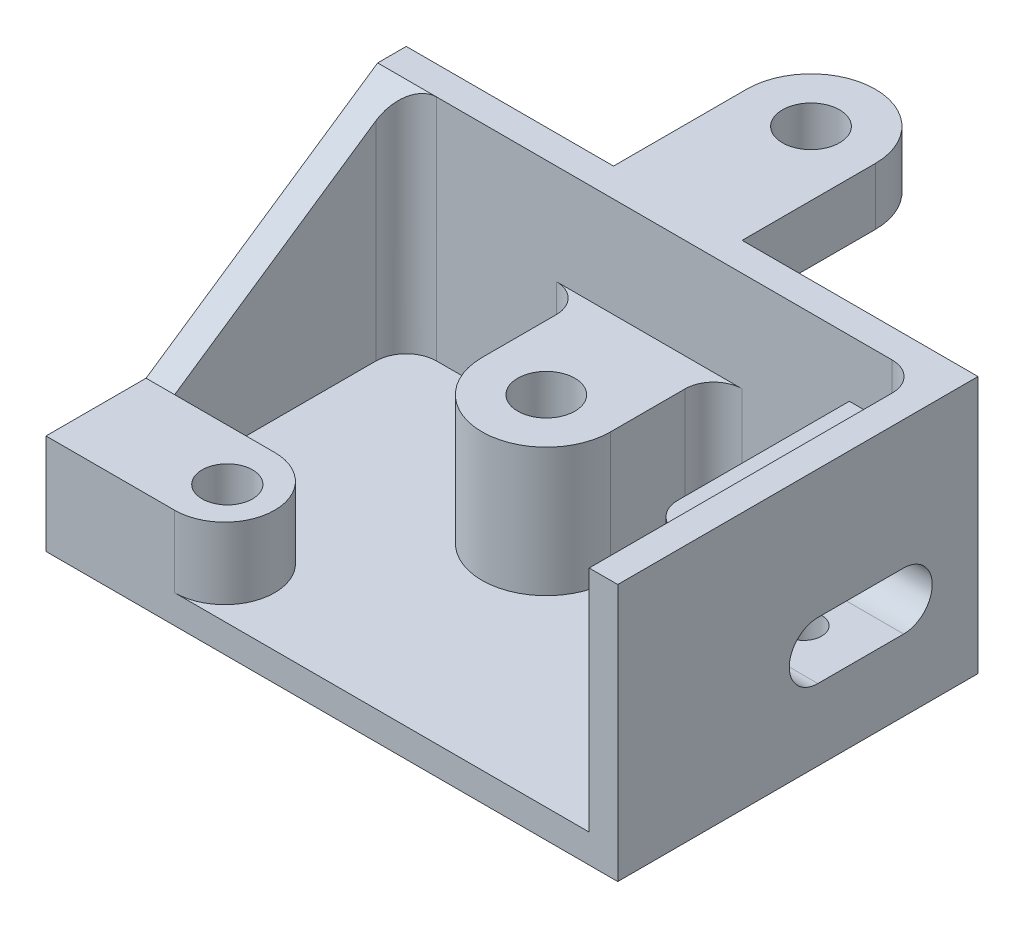
from build123d import *

# Parameters (mm, degrees)
BOSS_EXTRUDE1_DEPTH                                  = 6.35
BOSS_EXTRUDE2_DEPTH                                  = 57.15
BOSS_EXTRUDE3_DEPTH                                  = 44.45
BOSS_EXTRUDE4_DEPTH                                  = 34.925
SKETCH4_R                                            = 14.2875
SKETCH4_R_2                                          = 6.35
BOSS_EXTRUDE5_DEPTH                                  = 12.7
CUT_EXTRUDE1_REACH                                   = 159.28
BOSS_EXTRUDE6_DEPTH                                  = 15.875
CBORE_FOR_M5_CROSS_RECESS_PAN_HEAD_SCREW_D           = 11.2014
CBORE_FOR_M5_CROSS_RECESS_PAN_HEAD_SCREW_CBORE_D     = 15.875
CBORE_FOR_M5_CROSS_RECESS_PAN_HEAD_SCREW_CBORE_DEPTH = 3.175
CBORE_FOR_M5_CROSS_RECESS_PAN_HEAD_S_2_D             = 12.7
CBORE_FOR_M5_CROSS_RECESS_PAN_HEAD_S_2_CBORE_D       = 22.225
CBORE_FOR_M5_CROSS_RECESS_PAN_HEAD_S_2_CBORE_DEPTH   = 3.175
CUT_EXTRUDE3_REACH                                   = 159.28
CUT_EXTRUDE4_REACH                                   = 116.252
SKETCH18_R                                           = 4.0005


with BuildPart() as part:
    # Sketch1 → Boss-Extrude1 (new body)
    with BuildSketch(Plane(origin=(0, 0, 0), x_dir=(1, 0, 0), z_dir=(0, 1, 0))):
        with BuildLine():
            Line((60.325, 16.51822322), (60.325, -28.346886894))
            Line((60.325, -28.346886894), (60.325, -50.8))
            Line((60.325, -50.8), (66.675, -50.8))
            Line((66.675, -50.8), (66.675, 29.21822322))
            Line((66.675, 29.21822322), (-60.325, 29.21822322))
            Line((-60.325, 29.21822322), (-60.325, -50.8))
            Line((-60.325, -50.8), (-53.975, -50.8))
            Line((-53.975, -50.8), (-53.975, -44.45))
            Line((-53.975, -44.45), (-53.975, 16.103113106))
            ThreePointArc((-53.975, 16.103113106), (-51.993545123, 20.886768343), (-47.209889886, 22.86822322))
            Line((-47.209889886, 22.86822322), (-20.6375, 22.86822322))
            Line((-20.6375, 22.86822322), (20.6375, 22.86822322))
            Line((20.6375, 22.86822322), (44.45, 22.86822322))
            Line((44.45, 22.86822322), (53.975, 22.86822322))
            ThreePointArc((53.975, 22.86822322), (58.465128061, 21.00835128), (60.325, 16.51822322))
        make_face()
        with BuildLine():
            Line((60.325, -50.8), (60.325, -28.346886894))
            ThreePointArc((60.325, -28.346886894), (58.343545123, -23.563231657), (53.559889886, -21.58177678))
            Line((53.559889886, -21.58177678), (50.8, -21.58177678))
            ThreePointArc((50.8, -21.58177678), (46.309871939, -19.721904841), (44.45, -15.23177678))
            Line((44.45, -15.23177678), (44.45, 22.86822322))
            Line((44.45, 22.86822322), (20.6375, 22.86822322))
            ThreePointArc((20.6375, 22.86822322), (16.147371939, 21.00835128), (14.2875, 16.51822322))
            Line((14.2875, 16.51822322), (14.2875, 0))
            ThreePointArc((14.2875, 0), (0, -14.2875), (-14.2875, 0))
            Line((-14.2875, 0), (-14.2875, 16.51822322))
            ThreePointArc((-14.2875, 16.51822322), (-16.147371939, 21.00835128), (-20.6375, 22.86822322))
            Line((-20.6375, 22.86822322), (-47.209889886, 22.86822322))
            ThreePointArc((-47.209889886, 22.86822322), (-51.993545123, 20.886768343), (-53.975, 16.103113106))
            Line((-53.975, 16.103113106), (-53.975, -44.45))
            Line((-53.975, -44.45), (-53.975, -50.8))
            Line((-53.975, -50.8), (-47.625, -50.8))
            Line((-47.625, -50.8), (60.325, -50.8))
        make_face()
        with BuildLine():
            Line((-20.6375, 22.86822322), (20.6375, 22.86822322))
            ThreePointArc((20.6375, 22.86822322), (16.147371939, 21.00835128), (14.2875, 16.51822322))
            Line((14.2875, 16.51822322), (14.2875, 0))
            ThreePointArc((14.2875, 0), (0, -14.2875), (-14.2875, 0))
            Line((-14.2875, 0), (-14.2875, 16.51822322))
            ThreePointArc((-14.2875, 16.51822322), (-16.147371939, 21.00835128), (-20.6375, 22.86822322))
        make_face()
        with BuildLine():
            ThreePointArc((53.559889886, -21.58177678), (58.343545123, -23.563231657), (60.325, -28.346886894))
            Line((60.325, -28.346886894), (60.325, 16.51822322))
            ThreePointArc((60.325, 16.51822322), (58.465128061, 21.00835128), (53.975, 22.86822322))
            Line((53.975, 22.86822322), (44.45, 22.86822322))
            Line((44.45, 22.86822322), (44.45, -15.23177678))
            ThreePointArc((44.45, -15.23177678), (46.309871939, -19.721904841), (50.8, -21.58177678))
            Line((50.8, -21.58177678), (53.559889886, -21.58177678))
        make_face()
    extrude(amount=BOSS_EXTRUDE1_DEPTH)

    # Sketch1<4> → Boss-Extrude2 (add)
    with BuildSketch(Plane(origin=(0, 0, 0), x_dir=(1, 0, 0), z_dir=(0, 1, 0))):
        with BuildLine():
            Line((60.325, 16.51822322), (60.325, -28.346886894))
            Line((60.325, -28.346886894), (60.325, -50.8))
            Line((60.325, -50.8), (66.675, -50.8))
            Line((66.675, -50.8), (66.675, 29.21822322))
            Line((66.675, 29.21822322), (-60.325, 29.21822322))
            Line((-60.325, 29.21822322), (-60.325, -50.8))
            Line((-60.325, -50.8), (-53.975, -50.8))
            Line((-53.975, -50.8), (-53.975, -44.45))
            Line((-53.975, -44.45), (-53.975, 16.103113106))
            ThreePointArc((-53.975, 16.103113106), (-51.993545123, 20.886768343), (-47.209889886, 22.86822322))
            Line((-47.209889886, 22.86822322), (-20.6375, 22.86822322))
            Line((-20.6375, 22.86822322), (20.6375, 22.86822322))
            Line((20.6375, 22.86822322), (44.45, 22.86822322))
            Line((44.45, 22.86822322), (53.975, 22.86822322))
            ThreePointArc((53.975, 22.86822322), (58.465128061, 21.00835128), (60.325, 16.51822322))
        make_face()
    extrude(amount=BOSS_EXTRUDE2_DEPTH)

    # Sketch1<5> → Boss-Extrude3 (add)
    with BuildSketch(Plane(origin=(0, 0, 0), x_dir=(1, 0, 0), z_dir=(0, 1, 0))):
        with BuildLine():
            ThreePointArc((53.559889886, -21.58177678), (58.343545123, -23.563231657), (60.325, -28.346886894))
            Line((60.325, -28.346886894), (60.325, 16.51822322))
            ThreePointArc((60.325, 16.51822322), (58.465128061, 21.00835128), (53.975, 22.86822322))
            Line((53.975, 22.86822322), (44.45, 22.86822322))
            Line((44.45, 22.86822322), (44.45, -15.23177678))
            ThreePointArc((44.45, -15.23177678), (46.309871939, -19.721904841), (50.8, -21.58177678))
            Line((50.8, -21.58177678), (53.559889886, -21.58177678))
        make_face()
    extrude(amount=BOSS_EXTRUDE3_DEPTH)

    # Sketch1<6> → Boss-Extrude4 (add)
    with BuildSketch(Plane(origin=(0, 0, 0), x_dir=(1, 0, 0), z_dir=(0, 1, 0))):
        with BuildLine():
            Line((-20.6375, 22.86822322), (20.6375, 22.86822322))
            ThreePointArc((20.6375, 22.86822322), (16.147371939, 21.00835128), (14.2875, 16.51822322))
            Line((14.2875, 16.51822322), (14.2875, 0))
            ThreePointArc((14.2875, 0), (0, -14.2875), (-14.2875, 0))
            Line((-14.2875, 0), (-14.2875, 16.51822322))
            ThreePointArc((-14.2875, 16.51822322), (-16.147371939, 21.00835128), (-20.6375, 22.86822322))
        make_face()
    extrude(amount=BOSS_EXTRUDE4_DEPTH)

    # Sketch4 → Boss-Extrude5 (add)
    # profile 1 of 2: a face of its own
    with BuildSketch(Plane(origin=(0, 57.15, 0), x_dir=(1, 0, 0), z_dir=(0, 1, 0))):
        with BuildLine():
            ThreePointArc((14.2875, 58.801), (0, 44.5135), (-14.2875, 58.801))
            Line((-14.2875, 58.801), (-14.2875, 29.21822322))
            Line((-14.2875, 29.21822322), (14.2875, 29.21822322))
            Line((14.2875, 29.21822322), (14.2875, 58.801))
        make_face()
    # profile 2 of 2: a face of its own
    with BuildSketch(Plane(origin=(0, 57.15, 0), x_dir=(1, 0, 0), z_dir=(0, 1, 0))):
        with Locations((0, 58.801)):
            Circle(SKETCH4_R)
        with Locations(Location((0, 58.801, 0), (0, 0, 270))):
            Circle(SKETCH4_R_2, mode=Mode.SUBTRACT)
    extrude(amount=-BOSS_EXTRUDE5_DEPTH)

    # Sketch5 → Cut-Extrude1 (cut, up to next)
    with BuildSketch(Plane.ZY.offset(60.325), mode=Mode.PRIVATE) as cut_extrude1_sk1:
        Polygon((-22.86822322, 57.15), (28.575, 22.225), (50.8, 22.225), (50.8, 57.15), align=None)
    cut_extrude1_tool1 = extrude(cut_extrude1_sk1.sketch, amount=-CUT_EXTRUDE1_REACH, mode=Mode.PRIVATE) & part.part
    add(cut_extrude1_tool1.solids().sort_by_distance((-60.325, 42.810165, 24.526909))[0], mode=Mode.SUBTRACT)

    # Sketch6 → Boss-Extrude6 (add)
    with BuildSketch(Plane(origin=(0, 6.35, 0), x_dir=(1, 0, 0), z_dir=(0, 1, 0))):
        with BuildLine():
            Line((-31.75, -28.575), (-53.975, -28.575))
            Line((-53.975, -28.575), (-53.975, -50.8))
            Line((-53.975, -50.8), (-31.75, -50.8))
            ThreePointArc((-31.75, -50.8), (-20.6375, -39.6875), (-31.75, -28.575))
        make_face()
    extrude(amount=BOSS_EXTRUDE6_DEPTH)

    # CBORE for M5 Cross Recess Pan Head Screw (through all)
    with Locations(Plane(origin=(0, 0, 0), x_dir=(-1, 0, 0), z_dir=(0, -1, 0))):
        with Locations((30.873227599, -39.973489035)):
            CounterBoreHole(CBORE_FOR_M5_CROSS_RECESS_PAN_HEAD_SCREW_D / 2, CBORE_FOR_M5_CROSS_RECESS_PAN_HEAD_SCREW_CBORE_D / 2, CBORE_FOR_M5_CROSS_RECESS_PAN_HEAD_SCREW_CBORE_DEPTH)

    # CBORE for M5 Cross Recess Pan Head S 2 (through all)
    with Locations(Plane(origin=(0, 0, 0), x_dir=(-1, 0, 0), z_dir=(0, -1, 0))):
        with Locations((0, 0)):
            CounterBoreHole(CBORE_FOR_M5_CROSS_RECESS_PAN_HEAD_S_2_D / 2, CBORE_FOR_M5_CROSS_RECESS_PAN_HEAD_S_2_CBORE_D / 2, CBORE_FOR_M5_CROSS_RECESS_PAN_HEAD_S_2_CBORE_DEPTH)

    # Sketch16 → Cut-Extrude3 (cut, up to next)
    with BuildSketch(Plane(origin=(66.675, 0, 0), x_dir=(0, 0, -1), z_dir=(1, 0, 0)), mode=Mode.PRIVATE) as cut_extrude3_sk1:
        with BuildLine():
            Line((-6.35, 28.575), (12.7, 28.575))
            ThreePointArc((12.7, 28.575), (19.05, 22.225), (12.7, 15.875))
            Line((12.7, 15.875), (-6.35, 15.875))
            ThreePointArc((-6.35, 15.875), (-12.7, 22.225), (-6.35, 28.575))
        make_face()
    cut_extrude3_tool1 = extrude(cut_extrude3_sk1.sketch, amount=-CUT_EXTRUDE3_REACH, mode=Mode.PRIVATE) & part.part
    add(cut_extrude3_tool1.solids().sort_by_distance((66.675, 22.225, -3.175))[0], mode=Mode.SUBTRACT)

    # Sketch18 → Cut-Extrude4 (cut, up to next)
    with BuildSketch(Plane(origin=(0, 0, 0), x_dir=(-1, 0, 0), z_dir=(0, -1, 0)), mode=Mode.PRIVATE) as cut_extrude4_sk1:
        with Locations(Location((-53.975, 3.175, 0), (0, 0, 90))):
            Circle(SKETCH18_R)
    cut_extrude4_tool1 = extrude(cut_extrude4_sk1.sketch, amount=-CUT_EXTRUDE4_REACH, mode=Mode.PRIVATE) & part.part
    add(cut_extrude4_tool1.solids().sort_by_distance((53.975, 0, -3.175))[0], mode=Mode.SUBTRACT)


solid = part.part
